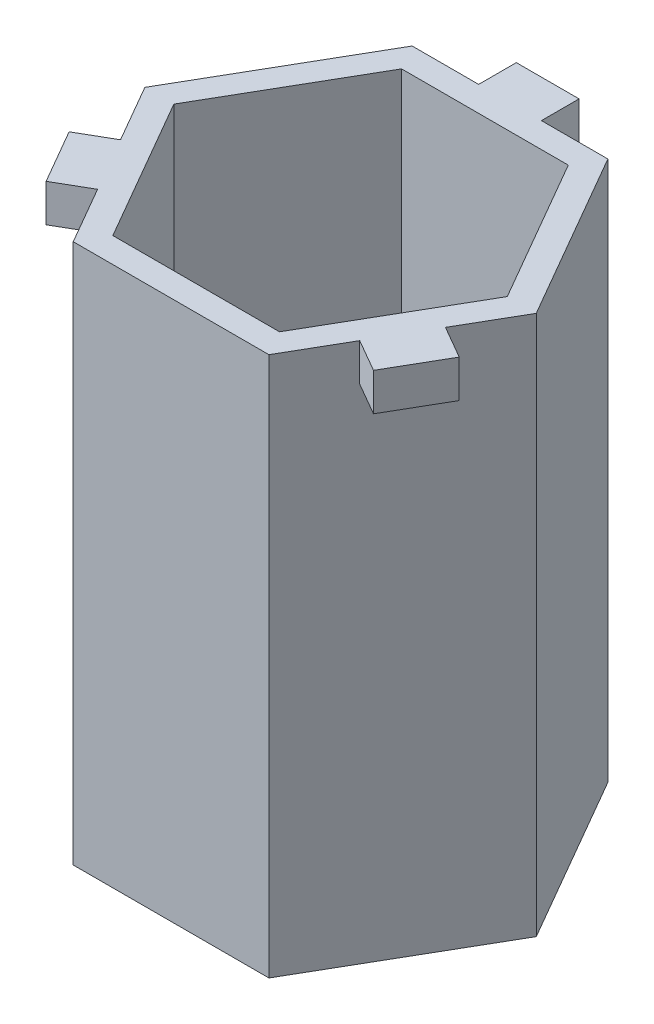
from build123d import *

# Parameters (mm, degrees)
SKETCH1_R           = 10.7
BOSS_EXTRUDE1_DEPTH = 43
CUT_EXTRUDE1_DEPTH  = 40
SKETCH3_W           = 5
SKETCH3_H           = 3
BOSS_EXTRUDE2_DEPTH = 3


with BuildPart() as part:
    # Sketch1 → Boss-Extrude1 (new body)
    with BuildSketch(Plane(origin=(0, 0, 0), x_dir=(1, 0, 0), z_dir=(0, 1, 0))):
        Polygon((15.588457268, 0), (7.794228634, 13.5), (-7.794228634, 13.5), (-15.588457268, 0), (-7.794228634, -13.5), (7.794228634, -13.5), align=None)
        with Locations(Location((0, 0, 0), (0, 0, 270))):
            Circle(SKETCH1_R, mode=Mode.SUBTRACT)
    extrude(amount=BOSS_EXTRUDE1_DEPTH)

    # Sketch2 → Cut-Extrude1 (cut)
    with BuildSketch(Plane(origin=(0, 43, 0), x_dir=(1, 0, 0), z_dir=(0, 1, 0))):
        Polygon((13.279056191, 0), (6.639528096, 11.5), (-6.639528096, 11.5), (-13.279056191, 0), (-6.639528096, -11.5), (6.639528096, -11.5), align=None)
    extrude(amount=-CUT_EXTRUDE1_DEPTH, mode=Mode.SUBTRACT)

    # Sketch3 → Boss-Extrude2 (add)
    with BuildSketch(Plane(origin=(0, 43, 0), x_dir=(1, 0, 0), z_dir=(0, 1, 0))):
        Polygon((15.539419162, -6.084936491), (12.941342951, -4.584936491), (10.441342951, -8.915063509), (13.039419162, -10.415063509), align=None)
        with Locations((0, 15)):
            Rectangle(SKETCH3_W, SKETCH3_H)
        Polygon((-13.039419162, -10.415063509), (-10.441342951, -8.915063509), (-12.941342951, -4.584936491), (-15.539419162, -6.084936491), align=None)
    extrude(amount=-BOSS_EXTRUDE2_DEPTH)


solid = part.part
